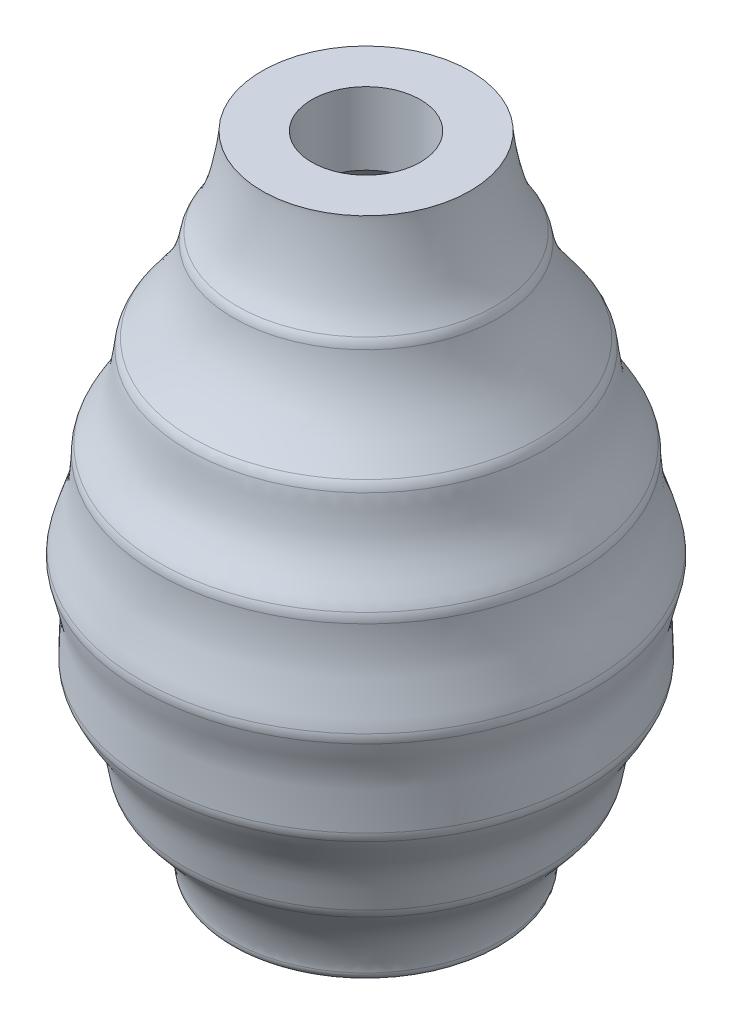
from build123d import *


with BuildPart() as part:
    # Sketch1 → Revolve1 (revolve)
    with BuildSketch(Plane.XY):
        with BuildLine():
            Line((0, 0), (0, 16.101785714))
            Line((0, 16.101785714), (0, 32.203571429))
            Line((0, 32.203571429), (0, 48.305357143))
            Line((0, 48.305357143), (0, 64.407142857))
            Line((0, 64.407142857), (0, 80.508928571))
            Line((0, 80.508928571), (0, 96.610714286))
            Line((0, 96.610714286), (0, 112.7125))
            Line((0, 112.7125), (18.25625, 112.7125))
            add(Edge.make_bspline(
                [(18.25625, 112.7125), (18.25625, 111.664430702), (19.341495829, 102.408033413), (22.27390025, 97.889934524), (22.61743, 97.372714286)],
                knots=[0, 0, 0, 0, 0.872612602, 1, 1, 1, 1], degree=3))
            ThreePointArc((22.61743, 97.372714286), (22.995746548, 96.642796505), (23.208670962, 95.848714286))
            add(Edge.make_bspline(
                [(23.208670962, 95.848714286), (23.640564895, 93.064108845), (25.385380124, 88.006304591), (28.50228818, 83.886532415), (30.491368604, 81.270928571)],
                knots=[0, 0, 0, 0, 0.46536303, 1, 1, 1, 1], degree=3))
            ThreePointArc((30.491368604, 81.270928571), (30.924245986, 80.547668517), (31.187501518, 79.746928571))
            add(Edge.make_bspline(
                [(31.187501518, 79.746928571), (31.48824056, 78.313393332), (31.630561276, 71.6958148), (35.591258042, 66.771828654), (36.27717165, 65.169142857)],
                knots=[0, 0, 0, 0, 0.454349821, 1, 1, 1, 1], degree=3))
            ThreePointArc((36.27717165, 65.169142857), (36.509342382, 64.422979593), (36.584394883, 63.645142857))
            add(Edge.make_bspline(
                [(36.584394883, 63.645142857), (36.572577769, 61.838829015), (36.891818962, 55.992483353), (39.047331694, 51.727258564), (39.606159568, 49.067357143)],
                knots=[0, 0, 0, 0, 0.46030167, 1, 1, 1, 1], degree=3))
            ThreePointArc((39.606159568, 49.067357143), (39.687497506, 48.305797501), (39.61487761, 47.543357143))
            add(Edge.make_bspline(
                [(39.61487761, 47.543357143), (39.204765294, 45.473919308), (37.396467453, 40.761008431), (38.135191193, 36.051002925), (38.168576567, 32.965571429)],
                knots=[0, 0, 0, 0, 0.421679208, 1, 1, 1, 1], degree=3))
            ThreePointArc((38.168576567, 32.965571429), (38.096988698, 32.188113286), (37.868425269, 31.441571429))
            add(Edge.make_bspline(
                [(37.868425269, 31.441571429), (36.693040272, 28.659520283), (33.240431438, 24.901286966), (32.425842379, 19.370398544), (31.971982421, 16.863785714)],
                knots=[0, 0, 0, 0, 0.517161253, 1, 1, 1, 1], degree=3))
            ThreePointArc((31.971982421, 16.863785714), (31.735435714, 16.066635423), (31.331588674, 15.339785714))
            add(Edge.make_bspline(
                [(31.331588674, 15.339785714), (29.64428117, 12.958636855), (25.399272517, 9.848104096), (23.749, 2.476085237), (23.749, 1.524)],
                knots=[0, 0, 0, 0, 0.647990658, 1, 1, 1, 1], degree=3))
            ThreePointArc((23.749, 1.524), (23.302630735, 0.446369265), (22.225, 0))
            Line((22.225, 0), (0, 0))
        make_face()
    revolve(axis=Axis((0, 64.407142857, 0), (0, 1, 0)))

    # Sketch3 → Cut-Revolve1 (revolve, cut)
    with BuildSketch(Plane.XY):
        with BuildLine():
            Line((0, 112.7125), (9.525, 112.7125))
            Line((9.525, 112.7125), (9.525, 100.0125))
            add(Edge.make_bspline(
                [(9.525, 100.0125), (48.092613646, 54.909035587), (17.78, 6.35)],
                knots=[0, 0, 0, 1, 1, 1], degree=2))
            Line((17.78, 6.35), (0, 6.35))
            Line((0, 6.35), (0, 112.7125))
        make_face()
    revolve(axis=Axis((0, 64.407142857, 0), (0, 1, 0)), mode=Mode.SUBTRACT)


solid = part.part
